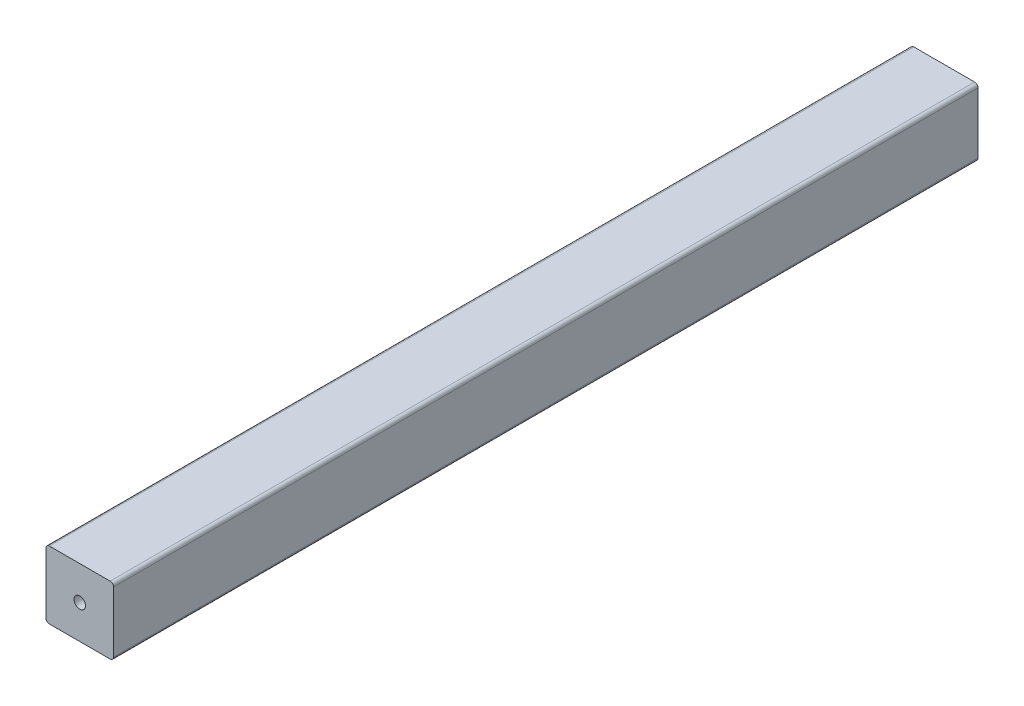
from build123d import *

# Parameters (mm, degrees)
SKETCH1_W           = 40
SKETCH1_H           = 40
SKETCH1_R           = 2.5
BOSS_EXTRUDE1_DEPTH = 256
FILLET1_R           = 2


with BuildPart() as part:
    # Sketch1 → Boss-Extrude1 (new, symmetric)
    with BuildSketch(Plane.XY):
        Rectangle(SKETCH1_W, SKETCH1_H)
        Circle(SKETCH1_R, mode=Mode.SUBTRACT)
    extrude(amount=BOSS_EXTRUDE1_DEPTH, both=True)

    # Fillet1
    fillet1_edges = [part.edges().sort_by_distance(p)[0] for p in [
        (20, -20, 0),
        (-20, -20, 0),
        (-20, 20, 0),
        (20, 20, 0),
    ]]
    fillet(fillet1_edges, radius=FILLET1_R)

    # Sketch9 → M8 Tapped Hole1 (revolve, cut)
    with BuildSketch(Plane(origin=(0, 0, 256), x_dir=(0, -1, 0), z_dir=(1, 0, 0))):
        Polygon((0, 0), (0, 29.792926105), (3.4, 27.75), (3.4, 0), align=None)
    m8_tapped_hole1 = revolve(axis=Axis((0, 0, 262.35), (0, 0, -1)), mode=Mode.SUBTRACT)

    # Mirror1: M8 Tapped Hole1 across plane
    add(m8_tapped_hole1.mirror(Plane.XY), mode=Mode.SUBTRACT)


solid = part.part
